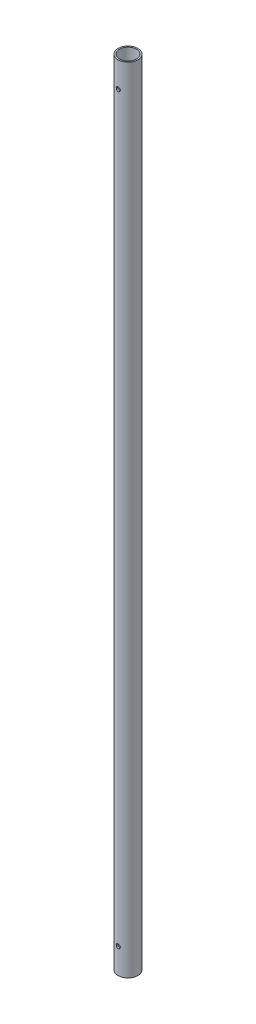
from build123d import *

# Parameters (mm, degrees)
SKETCH_1_R               = 7
EXTRUDE_1_DEPTH          = 560
CUT_EXTRUDE_1_DEPTH      = 561.087493165
CUT_EXTRUDE_1_DEPTH_BACK = 561.087493165
SKETCH_2_R               = 6
HOLE_WIZARD_M2_5_1_D     = 2.9


with BuildPart() as part:
    # 스케치1 → 보스-돌출1 (new body)
    with BuildSketch(Plane(origin=(0, 0, 0), x_dir=(1, 0, 0), z_dir=(0, 1, 0))):
        with Locations(Location((0, 0, 0), (0, 0, 270))):
            Circle(SKETCH_1_R)
    extrude(amount=EXTRUDE_1_DEPTH)

    # 스케치2 → 컷-돌출1 (cut, two sides: drawn at the far end of the back side and taken through both)
    with BuildSketch(Plane.XZ.offset(-CUT_EXTRUDE_1_DEPTH_BACK)):
        with Locations(Location((0, 0, 0), (0, 0, 270))):
            Circle(SKETCH_2_R)
    extrude(amount=CUT_EXTRUDE_1_DEPTH + CUT_EXTRUDE_1_DEPTH_BACK, mode=Mode.SUBTRACT)

    # M2.5 여유 구멍1 (through all)
    with Locations(Plane.XY.offset(7)):
        with Locations((0, 18), (0, 542)):
            Hole(HOLE_WIZARD_M2_5_1_D / 2)


solid = part.part
